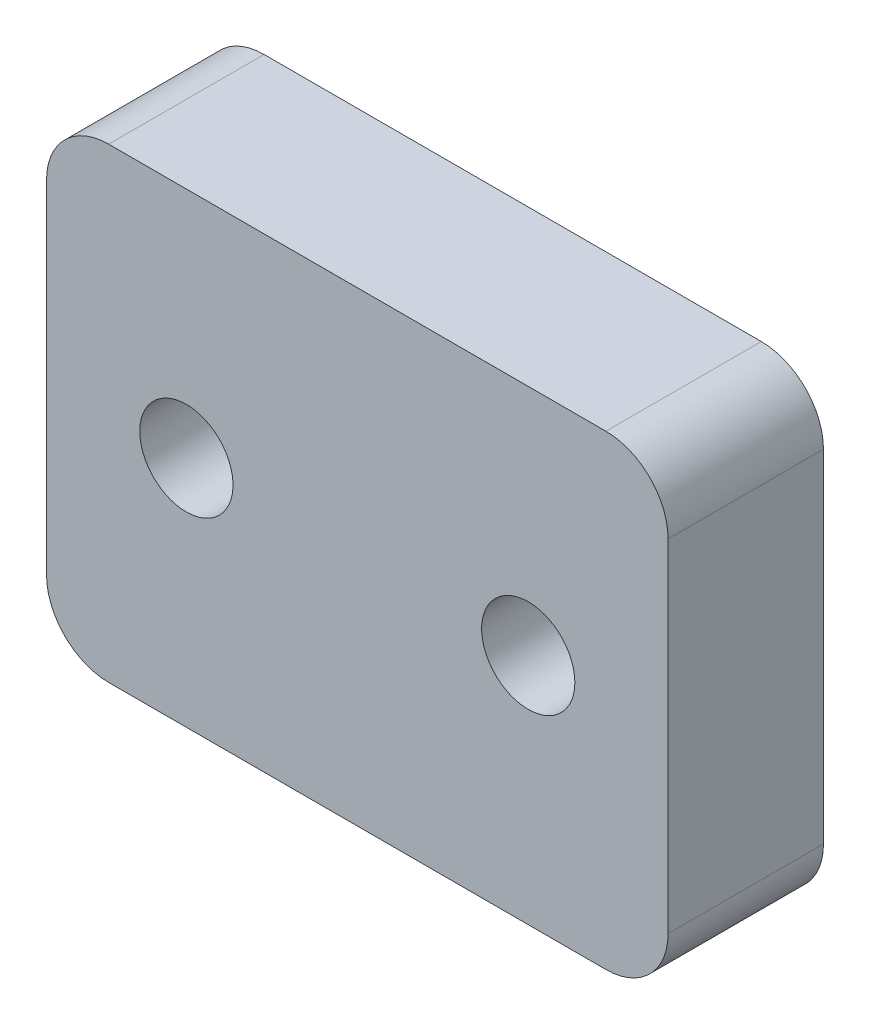
from build123d import *

# Parameters (mm, degrees)
SKETCH_1_W          = 20
SKETCH_1_H          = 15
EXTRUDE_1_DEPTH     = 5
SKETCH_3_R          = 1.5
CUT_EXTRUDE_2_DEPTH = 14.462912018
FILLET_1_R          = 2


with BuildPart() as part:
    # 草图1 → 凸台-拉伸1 (new body)
    with BuildSketch(Plane.XY):
        Rectangle(SKETCH_1_W, SKETCH_1_H)
    extrude(amount=EXTRUDE_1_DEPTH)

    # 草图3 → 切除-拉伸2 (cut, through all)
    with BuildSketch(Plane.XY.offset(5)):
        with Locations((5.5, 0)):
            Circle(SKETCH_3_R)
        with Locations(Location((-5.5, 0, 0), (0, 0, 180))):
            Circle(SKETCH_3_R)
    extrude(amount=-CUT_EXTRUDE_2_DEPTH, mode=Mode.SUBTRACT)

    # 圆角1
    fillet_1_edges = [part.edges().sort_by_distance(p)[0] for p in [
        (-10, 7.5, 2.5),
        (10, 7.5, 2.5),
        (10, -7.5, 2.5),
        (-10, -7.5, 2.5),
    ]]
    fillet(fillet_1_edges, radius=FILLET_1_R)


solid = part.part
